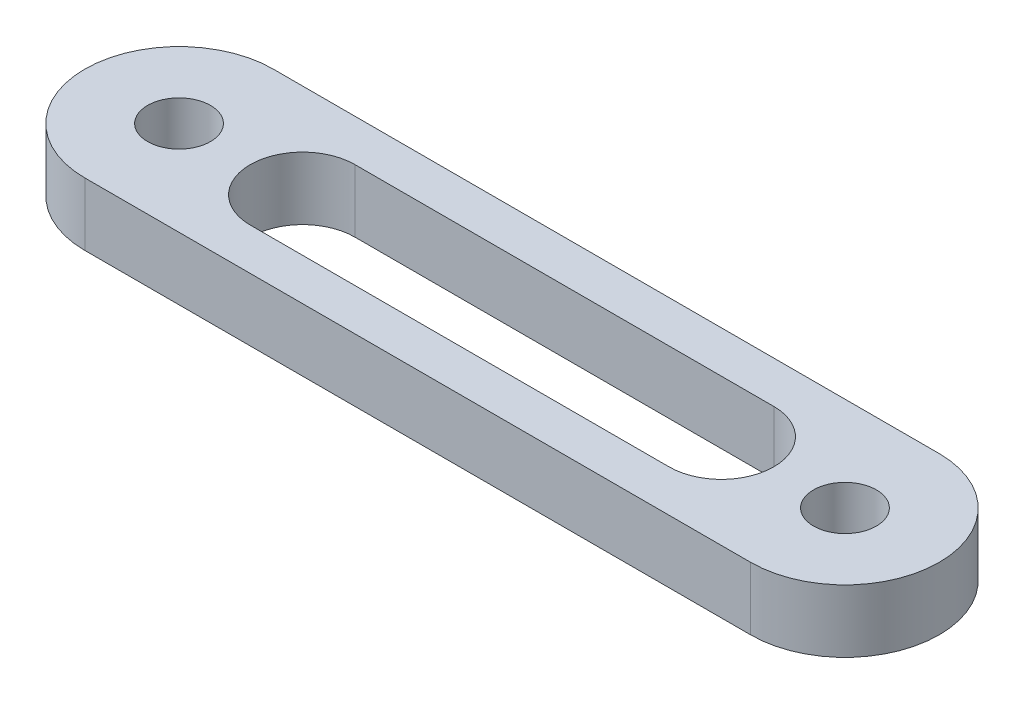
from build123d import *

# Parameters (mm, degrees)
SKETCH_1_R          = 1.5
EXTRUDE_1_DEPTH     = 3
CUT_EXTRUDE_1_DEPTH = 22.104738804


with BuildPart() as part:
    # 草图1 → 凸台-拉伸1 (new body)
    with BuildSketch(Plane(origin=(0, 0, 0), x_dir=(1, 0, 0), z_dir=(0, 1, 0))):
        with BuildLine():
            Line((15.9, 4.5), (-15.9, 4.5))
            ThreePointArc((-15.9, 4.5), (-20.4, 0), (-15.9, -4.5))
            Line((-15.9, -4.5), (15.9, -4.5))
            ThreePointArc((15.9, -4.5), (20.4, 0), (15.9, 4.5))
        make_face()
        with Locations(Location((-15.9, 0, 0), (0, 0, 270))):
            Circle(SKETCH_1_R, mode=Mode.SUBTRACT)
        with Locations(Location((15.9, 0, 0), (0, 0, 270))):
            Circle(SKETCH_1_R, mode=Mode.SUBTRACT)
    extrude(amount=EXTRUDE_1_DEPTH)

    # 草图2 → 切除-拉伸1 (cut, through all)
    with BuildSketch(Plane(origin=(0, 3, 0), x_dir=(1, 0, 0), z_dir=(0, 1, 0))):
        with BuildLine():
            Line((-10, 2.5), (10, 2.5))
            ThreePointArc((10, 2.5), (12.5, 0), (10, -2.5))
            Line((10, -2.5), (-10, -2.5))
            ThreePointArc((-10, -2.5), (-12.5, 0), (-10, 2.5))
        make_face()
    extrude(amount=-CUT_EXTRUDE_1_DEPTH, mode=Mode.SUBTRACT)


solid = part.part
